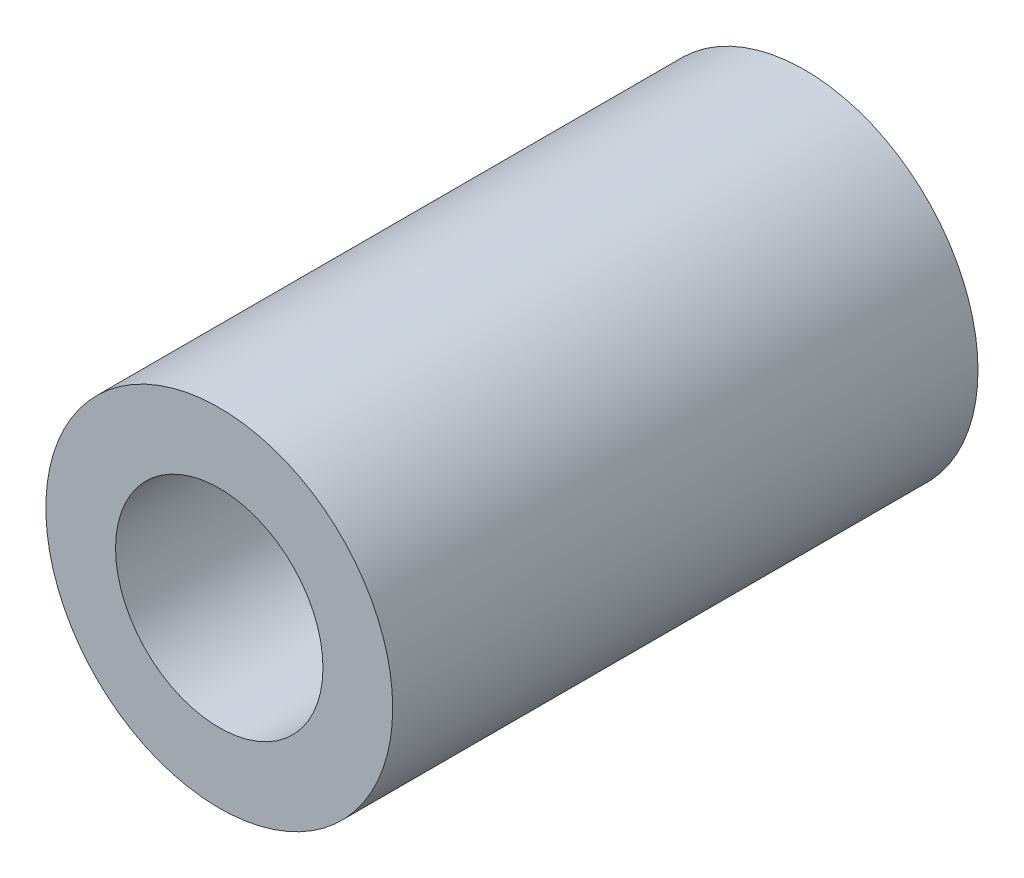
from build123d import *

# Parameters (mm, degrees)
SKETCH1_R           = 3.175
SKETCH1_R_2         = 1.89865
BOSS_EXTRUDE1_DEPTH = 10.715625


with BuildPart() as part:
    # Sketch1 → Boss-Extrude1 (new body)
    with BuildSketch(Plane.XY):
        Circle(SKETCH1_R)
        Circle(SKETCH1_R_2, mode=Mode.SUBTRACT)
    extrude(amount=BOSS_EXTRUDE1_DEPTH)


solid = part.part
